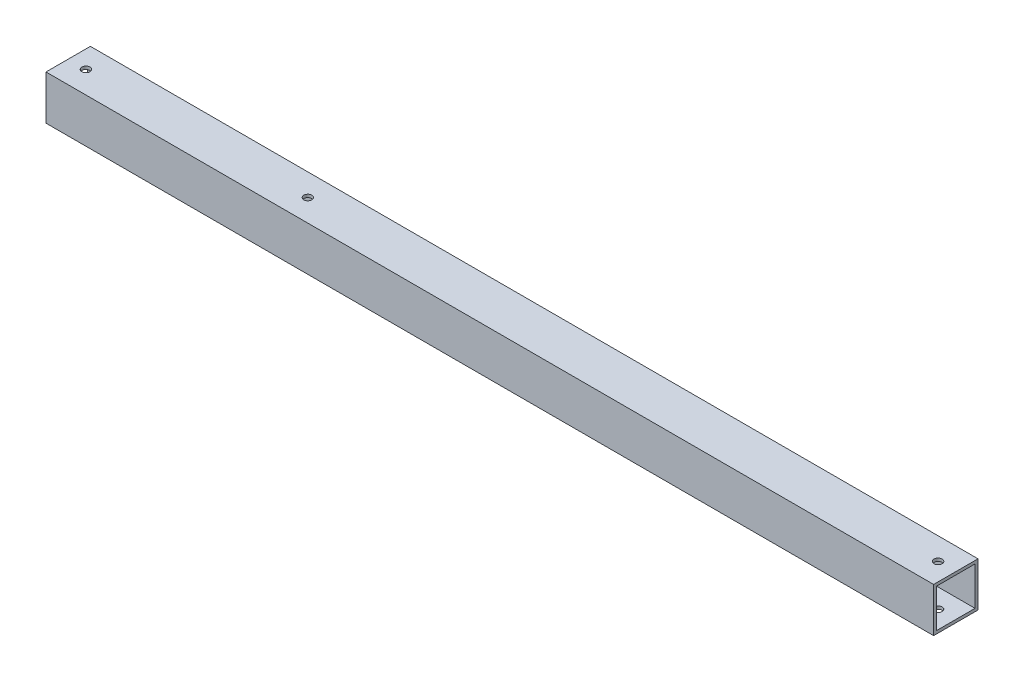
from build123d import *

# Parameters (mm, degrees)
SKETCH1_W               = 30
SKETCH1_H               = 30
SKETCH1_W_2             = 26
SKETCH1_H_2             = 26
BOSS_EXTRUDE1_DEPTH     = 300
SKETCH2_R               = 2.75
CUT_EXTRUDE1_DEPTH      = 301.749064836
CUT_EXTRUDE2_DEPTH      = 301.749064836
CUT_EXTRUDE2_DEPTH_BACK = 301.749064836
SKETCH3_R               = 2.75


with BuildPart() as part:
    # Sketch1 → Boss-Extrude1 (new, symmetric)
    with BuildSketch(Plane(origin=(0, 0, 0), x_dir=(0, 0, -1), z_dir=(1, 0, 0))):
        Rectangle(SKETCH1_W, SKETCH1_H)
        Rectangle(SKETCH1_W_2, SKETCH1_H_2, mode=Mode.SUBTRACT)
    extrude(amount=BOSS_EXTRUDE1_DEPTH, both=True)

    # Sketch2 → Cut-Extrude1 (cut, symmetric)
    with BuildSketch(Plane(origin=(0, 0, 0), x_dir=(1, 0, 0), z_dir=(0, 1, 0))):
        with Locations(Location((288, 0, 0), (0, 0, 270))):
            Circle(SKETCH2_R)
    cut_extrude1 = extrude(amount=CUT_EXTRUDE1_DEPTH, both=True, mode=Mode.SUBTRACT)

    # Mirror1: Cut-Extrude1 across plane
    add(cut_extrude1.mirror(Plane(origin=(0, 0, 0), x_dir=(0, 0, 1), z_dir=(1, 0, 0))), mode=Mode.SUBTRACT)

    # Sketch3 → Cut-Extrude2 (cut, two sides: drawn at the far end of the back side and taken through both)
    with BuildSketch(Plane(origin=(0, 0, 0), x_dir=(1, 0, 0), z_dir=(0, 1, 0)).offset(-CUT_EXTRUDE2_DEPTH_BACK)):
        with Locations(Location((-138, 0, 0), (0, 0, 270))):
            Circle(SKETCH3_R)
    extrude(amount=CUT_EXTRUDE2_DEPTH + CUT_EXTRUDE2_DEPTH_BACK, mode=Mode.SUBTRACT)


solid = part.part
